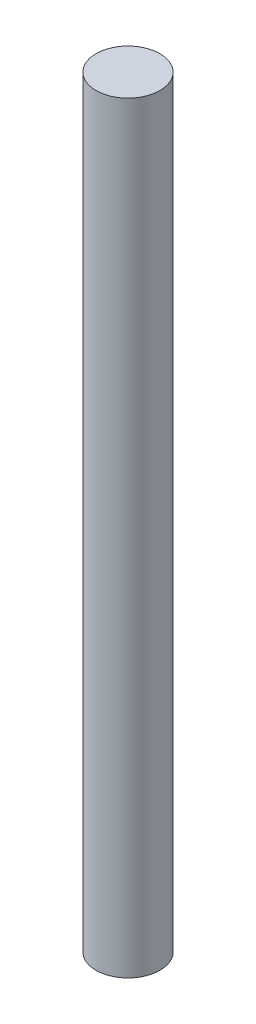
from build123d import *

# Parameters (mm, degrees)
CROQUIS1_R              = 5
SALIENTE_EXTRUIR1_DEPTH = 40.3
CROQUIS2_R              = 5
SALIENTE_EXTRUIR2_DEPTH = 79


with BuildPart() as part:
    # Croquis1 → Saliente-Extruir1 (new body)
    with BuildSketch(Plane(origin=(0, 0, 0), x_dir=(1, 0, 0), z_dir=(0, 1, 0))):
        with Locations(Location((0, 0, 0), (0, 0, 270))):
            Circle(CROQUIS1_R)
    extrude(amount=SALIENTE_EXTRUIR1_DEPTH)

    # Croquis2 → Saliente-Extruir2 (add)
    with BuildSketch(Plane(origin=(0, 40.3, 0), x_dir=(1, 0, 0), z_dir=(0, 1, 0))):
        with Locations(Location((0, 0, 0), (0, 0, 270))):
            Circle(CROQUIS2_R)
    extrude(amount=SALIENTE_EXTRUIR2_DEPTH)


solid = part.part
